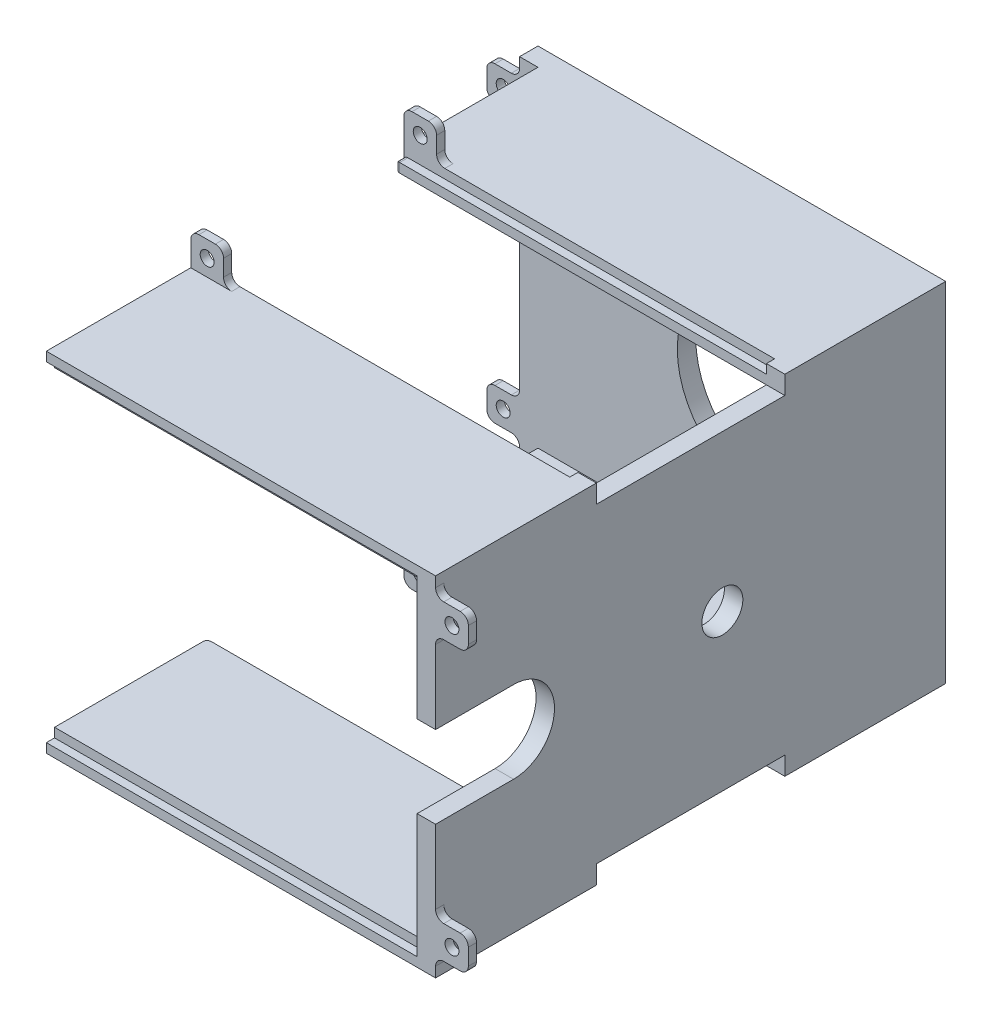
from build123d import *

# Parameters (mm, degrees)
SKETCH1_W                = 85
SKETCH1_H                = 95
BOSS_EXTRUDE1_DEPTH      = 4.5
SKETCH2_W                = 4.5
SKETCH2_H                = 85
BOSS_EXTRUDE2_DEPTH      = 120
SKETCH3_W                = 90.5
SKETCH3_H                = 4.5
BOSS_EXTRUDE3_DEPTH      = 120
CUT_EXTRUDE1_REACH       = 141.867
SKETCH4_R                = 22.5
CUT_EXTRUDE3_DEPTH       = 163.269837
SKETCH8_W                = 2.25
SKETCH8_H                = 2
CUT_EXTRUDE4_DEPTH       = 90.5
SKETCH9_W                = 85
SKETCH9_H                = 4.5
BOSS_EXTRUDE5_DEPTH      = 4.5
SKETCH11_W               = 40
SKETCH11_H               = 50
BOSS_EXTRUDE7_DEPTH      = 10
SKETCH12_W               = 30.5
SKETCH12_H               = 40.5
CUT_EXTRUDE5_DEPTH       = 10
SKETCH13_R               = 5
CUT_EXTRUDE6_DEPTH       = 163.269837
SKETCH14_W               = 8
SKETCH14_H               = 2
BOSS_EXTRUDE8_DEPTH      = 8
CUT_EXTRUDE8_DEPTH       = 143.782176759
CUT_EXTRUDE8_DEPTH_BACK  = 143.782176759
SKETCH16_R               = 1.7
SKETCH17_W               = 8
SKETCH17_H               = 2
BOSS_EXTRUDE9_DEPTH      = 8
CUT_EXTRUDE9_DEPTH       = 143.443848586
CUT_EXTRUDE9_DEPTH_BACK  = 143.443848586
SKETCH18_R               = 1.7
SKETCH19_W               = 2.25
SKETCH19_H               = 2
BOSS_EXTRUDE10_DEPTH     = 4.5
SKETCH20_W               = 8
SKETCH20_H               = 2
BOSS_EXTRUDE11_DEPTH     = 8
SKETCH22_W               = 8
SKETCH22_H               = 2
BOSS_EXTRUDE12_DEPTH     = 8
CUT_EXTRUDE10_DEPTH      = 119.80998485
CUT_EXTRUDE10_DEPTH_BACK = 119.80998485
SKETCH21_R               = 1.7
FILLET2_R                = 2
FILLET3_R                = 1
CUT_EXTRUDE11_DEPTH      = 170.291169291
CUT_EXTRUDE11_DEPTH_BACK = 170.291169291


with BuildPart() as part:
    # Sketch1 → Boss-Extrude1 (new body)
    with BuildSketch(Plane(origin=(0, 0, 0), x_dir=(0, 1, 0), z_dir=(0, 0, 1))):
        Rectangle(SKETCH1_W, SKETCH1_H)
    extrude(amount=BOSS_EXTRUDE1_DEPTH)

    # Sketch2 → Boss-Extrude2 (add)
    with BuildSketch(Plane.XY.offset(4.5)):
        with Locations((45.25, 0)):
            Rectangle(SKETCH2_W, SKETCH2_H)
    extrude(amount=BOSS_EXTRUDE2_DEPTH)

    # Sketch3 → Boss-Extrude3 (add)
    with BuildSketch(Plane.XY.offset(4.5)):
        with Locations((-2.25, 40.25)):
            Rectangle(SKETCH3_W, SKETCH3_H)
        with Locations((-2.25, -40.25)):
            Rectangle(SKETCH3_W, SKETCH3_H)
    extrude(amount=BOSS_EXTRUDE3_DEPTH)

    # Sketch4 → Cut-Extrude1 (cut, up to next)
    with BuildSketch(Plane(origin=(0, 0, 0), x_dir=(1, 0, 0), z_dir=(0, 0, -1)), mode=Mode.PRIVATE) as cut_extrude1_sk1:
        with Locations(Location((9, 0, 0), (0, 0, 180))):
            Circle(SKETCH4_R)
    cut_extrude1_tool1 = extrude(cut_extrude1_sk1.sketch, amount=-CUT_EXTRUDE1_REACH, mode=Mode.PRIVATE) & part.part
    add(cut_extrude1_tool1.solids().sort_by_distance((9, 0, 0))[0], mode=Mode.SUBTRACT)

    # Sketch7 → Cut-Extrude3 (cut, through all)
    with BuildSketch(Plane(origin=(-47.5, 0, 0), x_dir=(0, -1, 0), z_dir=(-1, 0, 0))):
        Polygon((-38, 85.25), (-40.25, 85.25), (-40.25, 87.25), (-42.5, 87.25), (-42.5, 37.25), (-40.25, 37.25), (-40.25, 39.25), (-38, 39.25), align=None)
        Polygon((40.25, 39.25), (38, 39.25), (38, 85.25), (40.25, 85.25), (40.25, 87.25), (42.5, 87.25), (42.5, 37.25), (40.25, 37.25), align=None)
    extrude(amount=-CUT_EXTRUDE3_DEPTH, mode=Mode.SUBTRACT)

    # Sketch8 → Cut-Extrude4 (cut)
    with BuildSketch(Plane(origin=(-47.5, 0, 0), x_dir=(0, -1, 0), z_dir=(-1, 0, 0))):
        with Locations((-39.125, 123.5)):
            Rectangle(SKETCH8_W, SKETCH8_H)
        with Locations((39.125, 123.5)):
            Rectangle(SKETCH8_W, SKETCH8_H)
    extrude(amount=-CUT_EXTRUDE4_DEPTH, mode=Mode.SUBTRACT)

    # Sketch9 → Boss-Extrude5 (add)
    with BuildSketch(Plane(origin=(-47.5, 0, 0), x_dir=(0, -1, 0), z_dir=(-1, 0, 0))):
        with Locations((0, 2.25)):
            Rectangle(SKETCH9_W, SKETCH9_H)
    extrude(amount=BOSS_EXTRUDE5_DEPTH)

    # Sketch11 → Boss-Extrude7 (add)
    with BuildSketch(Plane(origin=(43, 0, 0), x_dir=(0, -1, 0), z_dir=(-1, 0, 0))):
        with Locations((0, 54.5)):
            Rectangle(SKETCH11_W, SKETCH11_H)
    extrude(amount=BOSS_EXTRUDE7_DEPTH)

    # Sketch12 → Cut-Extrude5 (cut)
    with BuildSketch(Plane(origin=(33, 0, 0), x_dir=(0, -1, 0), z_dir=(-1, 0, 0))):
        with Locations((0, 54.5)):
            Rectangle(SKETCH12_W, SKETCH12_H)
    extrude(amount=-CUT_EXTRUDE5_DEPTH, mode=Mode.SUBTRACT)

    # Sketch13 → Cut-Extrude6 (cut, through all)
    with BuildSketch(Plane(origin=(43, 0, 0), x_dir=(0, -1, 0), z_dir=(-1, 0, 0))):
        with Locations(Location((0, 54.5, 0), (0, 0, 90))):
            Circle(SKETCH13_R)
    extrude(amount=-CUT_EXTRUDE6_DEPTH, mode=Mode.SUBTRACT)

    # Sketch14 → Boss-Extrude8 (add)
    with BuildSketch(Plane.YZ.offset(47.5)):
        with Locations((-34, 123.5)):
            Rectangle(SKETCH14_W, SKETCH14_H)
        with Locations((34, 123.5)):
            Rectangle(SKETCH14_W, SKETCH14_H)
    extrude(amount=BOSS_EXTRUDE8_DEPTH)

    # Sketch16 → Cut-Extrude8 (cut, two sides: drawn at the far end of the back side and taken through both)
    with BuildSketch(Plane.XY.offset(124.5).offset(-CUT_EXTRUDE8_DEPTH_BACK)):
        with Locations((51.5, 34)):
            Circle(SKETCH16_R)
        with Locations((51.5, -34)):
            Circle(SKETCH16_R)
    extrude(amount=CUT_EXTRUDE8_DEPTH + CUT_EXTRUDE8_DEPTH_BACK, mode=Mode.SUBTRACT)

    # Sketch17 → Boss-Extrude9 (add)
    with BuildSketch(Plane(origin=(-52, 0, 0), x_dir=(0, -1, 0), z_dir=(-1, 0, 0))):
        with Locations((-34, 3.5)):
            Rectangle(SKETCH17_W, SKETCH17_H)
        with Locations((34, 3.5)):
            Rectangle(SKETCH17_W, SKETCH17_H)
    extrude(amount=BOSS_EXTRUDE9_DEPTH)

    # Sketch18 → Cut-Extrude9 (cut, two sides: drawn at the far end of the back side and taken through both)
    with BuildSketch(Plane(origin=(0, 0, 2.5), x_dir=(1, 0, 0), z_dir=(0, 0, -1)).offset(-CUT_EXTRUDE9_DEPTH_BACK)):
        with Locations(Location((-56, -34, 0), (0, 0, 180))):
            Circle(SKETCH18_R)
        with Locations(Location((-56, 34, 0), (0, 0, 180))):
            Circle(SKETCH18_R)
    extrude(amount=CUT_EXTRUDE9_DEPTH + CUT_EXTRUDE9_DEPTH_BACK, mode=Mode.SUBTRACT)

    # Sketch19 → Boss-Extrude10 (add)
    with BuildSketch(Plane.YZ.offset(47.5)):
        with Locations((-41.375, 86.25)):
            Rectangle(SKETCH19_W, SKETCH19_H)
        with Locations((-41.375, 38.25)):
            Rectangle(SKETCH19_W, SKETCH19_H)
        with Locations((41.375, 38.25)):
            Rectangle(SKETCH19_W, SKETCH19_H)
        with Locations((41.375, 86.25)):
            Rectangle(SKETCH19_W, SKETCH19_H)
    extrude(amount=-BOSS_EXTRUDE10_DEPTH)

    # Sketch20 → Boss-Extrude11 (add)
    with BuildSketch(Plane(origin=(0, 42.5, 0), x_dir=(-1, 0, 0), z_dir=(0, 1, 0))):
        with Locations((43.5, 36.25)):
            Rectangle(SKETCH20_W, SKETCH20_H)
        with Locations((43.5, 88.25)):
            Rectangle(SKETCH20_W, SKETCH20_H)
    extrude(amount=BOSS_EXTRUDE11_DEPTH)

    # Sketch22 → Boss-Extrude12 (add)
    with BuildSketch(Plane.XZ.offset(42.5)):
        with Locations((-43.5, 36.25)):
            Rectangle(SKETCH22_W, SKETCH22_H)
        with Locations((-43.5, 88.25)):
            Rectangle(SKETCH22_W, SKETCH22_H)
    extrude(amount=BOSS_EXTRUDE12_DEPTH)

    # Sketch21 → Cut-Extrude10 (cut, two sides: drawn at the far end of the back side and taken through both)
    with BuildSketch(Plane(origin=(0, 0, 35.25), x_dir=(1, 0, 0), z_dir=(0, 0, -1)).offset(-CUT_EXTRUDE10_DEPTH_BACK)):
        with Locations(Location((-43.5, -46.5, 0), (0, 0, 180))):
            Circle(SKETCH21_R)
        with Locations(Location((-43.5, 46.5, 0), (0, 0, 180))):
            Circle(SKETCH21_R)
    extrude(amount=CUT_EXTRUDE10_DEPTH + CUT_EXTRUDE10_DEPTH_BACK, mode=Mode.SUBTRACT)

    # Fillet2
    fillet2_edges = [part.edges().sort_by_distance(p)[0] for p in [
        (47.5, -38, 123.5),
        (47.5, -30, 123.5),
        (55.5, -38, 123.5),
        (55.5, -30, 123.5),
        (47.5, 38, 123.5),
        (47.5, 30, 123.5),
        (55.5, 38, 123.5),
        (55.5, 30, 123.5),
        (-52, 38, 3.5),
        (-52, 30, 3.5),
        (-60, 38, 3.5),
        (-60, 30, 3.5),
        (-52, -38, 3.5),
        (-52, -30, 3.5),
        (-60, -38, 3.5),
        (-60, -30, 3.5),
        (-39.5, 42.5, 36.25),
        (-47.5, 50.5, 36.25),
        (-39.5, 50.5, 36.25),
        (-39.5, 42.5, 88.25),
        (-47.5, 50.5, 88.25),
        (-39.5, 50.5, 88.25),
        (-39.5, -42.5, 36.25),
        (-47.5, -50.5, 36.25),
        (-39.5, -50.5, 36.25),
        (-39.5, -42.5, 88.25),
        (-47.5, -50.5, 88.25),
        (-39.5, -50.5, 88.25),
    ]]
    fillet(fillet2_edges, radius=FILLET2_R)

    # Fillet3
    fillet3_edges = [part.edges().sort_by_distance(p)[0] for p in [
        (-47.5, -39.125, 39.25),
        (-47.5, 39.125, 85.25),
        (-47.5, 40.25, 86.25),
        (-47.5, 40.25, 38.25),
        (-47.5, 39.125, 39.25),
        (-47.5, -40.25, 38.25),
        (-47.5, -40.25, 86.25),
        (-47.5, -39.125, 85.25),
    ]]
    fillet(fillet3_edges, radius=FILLET3_R)

    # Sketch23 → Cut-Extrude11 (cut, two sides: drawn at the far end of the back side and taken through both)
    with BuildSketch(Plane(origin=(43, 0, 0), x_dir=(0, -1, 0), z_dir=(-1, 0, 0)).offset(-CUT_EXTRUDE11_DEPTH_BACK)):
        with BuildLine():
            Line((-10, 124.5), (-10, 105.472696854))
            ThreePointArc((-10, 105.472696854), (0, 95.472696854), (10, 105.472696854))
            Line((10, 105.472696854), (10, 124.5))
            Line((10, 124.5), (-10, 124.5))
        make_face()
    extrude(amount=CUT_EXTRUDE11_DEPTH + CUT_EXTRUDE11_DEPTH_BACK, mode=Mode.SUBTRACT)


solid = part.part
